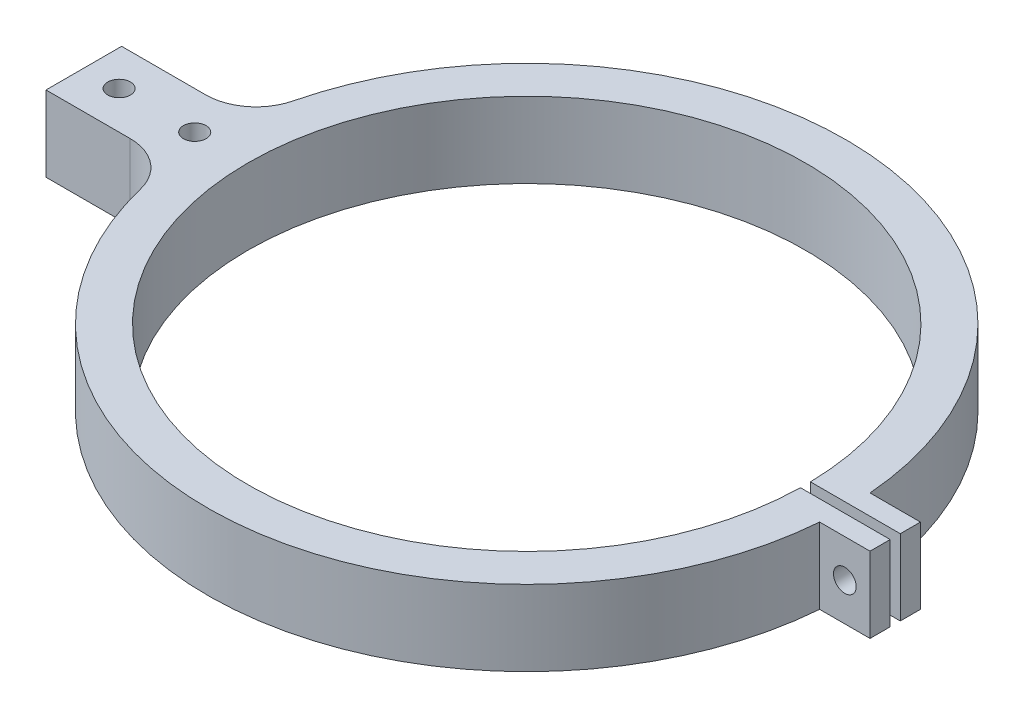
from build123d import *

# Parameters (mm, degrees)
SKETCH1_R           = 2.25
BOSS_EXTRUDE1_DEPTH = 15
SKETCH2_R           = 2.25
CUT_EXTRUDE1_DEPTH  = 20
FILLET1_R           = 10


with BuildPart() as part:
    # Sketch1 → Boss-Extrude1 (new body)
    with BuildSketch(Plane(origin=(0, 0, 0), x_dir=(1, 0, 0), z_dir=(0, 1, 0))):
        with BuildLine():
            Line((-87.85411681, -7.5), (-62.85411681, -7.5))
            ThreePointArc((-62.85411681, -7.5), (1.256140371, -63.287535197), (63.102218661, -5))
            Line((63.102218661, -5), (73.102218661, -5))
            Line((73.102218661, -5), (73.102218661, -1))
            Line((73.102218661, -1), (55.290957669, -1))
            ThreePointArc((55.290957669, -1), (-55.3, 0), (55.290957669, 1))
            Line((55.290957669, 1), (73.102218661, 1))
            Line((73.102218661, 1), (73.102218661, 5))
            Line((73.102218661, 5), (63.102218661, 5))
            ThreePointArc((63.102218661, 5), (1.256140371, 63.287535197), (-62.85411681, 7.5))
            Line((-62.85411681, 7.5), (-87.85411681, 7.5))
            Line((-87.85411681, 7.5), (-87.85411681, -7.5))
        make_face()
        with Locations(Location((-80.85411681, 0, 0), (0, 0, 270))):
            Circle(SKETCH1_R, mode=Mode.SUBTRACT)
        with Locations(Location((-65.85411681, 0, 0), (0, 0, 270))):
            Circle(SKETCH1_R, mode=Mode.SUBTRACT)
    extrude(amount=BOSS_EXTRUDE1_DEPTH)

    # Sketch2 → Cut-Extrude1 (cut)
    with BuildSketch(Plane.XY.offset(5)):
        with Locations((68.102218661, 7.5)):
            Circle(SKETCH2_R)
    extrude(amount=-CUT_EXTRUDE1_DEPTH, mode=Mode.SUBTRACT)

    # Fillet1
    fillet1_edges = [part.edges().sort_by_distance(p)[0] for p in [
        (-62.85411681, 7.5, 7.5),
        (-62.85411681, 7.5, -7.5),
    ]]
    fillet(fillet1_edges, radius=FILLET1_R)


solid = part.part
